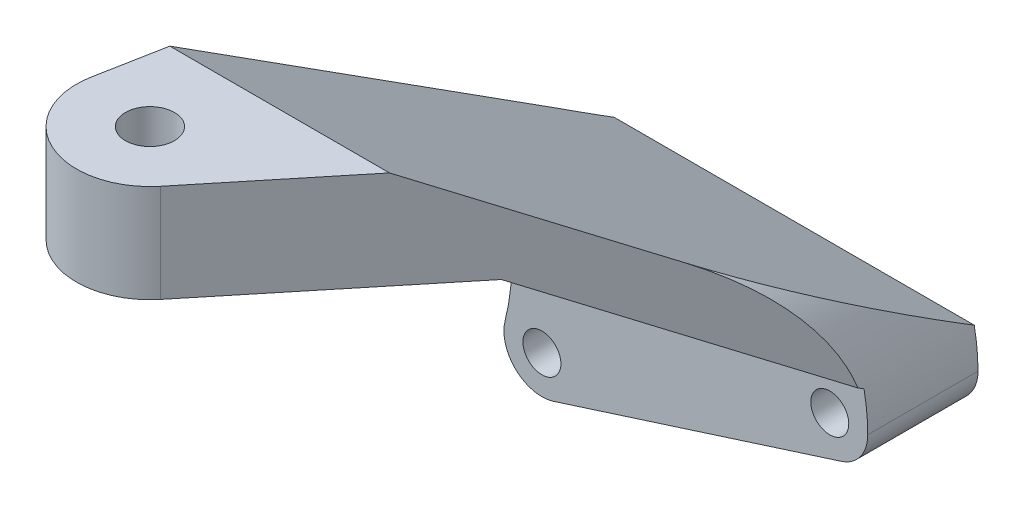
from build123d import *

# Parameters (mm, degrees)
SKETCH1_R            = 1.55
BOSS_EXTRUDE1_DEPTH  = 9
BOSS_EXTRUDE12_DEPTH = 17.39274351
SKETCH7_3_OUTSIDE_W  = 51.494
SKETCH7_3_OUTSIDE_H  = 57.894
SKETCH7_3_OUTSIDE_R  = 2
CUT_EXTRUDE3_DEPTH   = 17.39274351
CUT_EXTRUDE2_DEPTH   = 50
CUT_EXTRUDE5_DEPTH   = 58.797577804
CUT_EXTRUDE7_DEPTH   = 58.797577804
SKETCH15_W           = 41.045636652
SKETCH15_H           = 32.401588668
CUT_EXTRUDE8_DEPTH   = 58.797577804


with BuildPart() as part:
    # Sketch1 → Boss-Extrude1 (new body)
    with BuildSketch(Plane.XY):
        with BuildLine():
            Line((26.6, 7.50725649), (26.6, 10.60725649))
            Line((26.6, 10.60725649), (-3.1, 10.60725649))
            Line((-3.1, 10.60725649), (-3.1, 0))
            ThreePointArc((-3.1, 0), (-1.828333755, -2.503436774), (0.943352052, -2.952979327))
            Line((0.943352052, -2.952979327), (24.443352052, 4.554277162))
            ThreePointArc((24.443352052, 4.554277162), (26.003436774, 5.678922735), (26.6, 7.50725649))
        make_face()
        Circle(SKETCH1_R, mode=Mode.SUBTRACT)
        with Locations((23.5, 7.50725649)):
            Circle(SKETCH1_R, mode=Mode.SUBTRACT)
    extrude(amount=-BOSS_EXTRUDE1_DEPTH)

    # Sketch7 → Boss-Extrude12 (add)
    with BuildSketch(Plane(origin=(0, 28, 0), x_dir=(1, 0, 0), z_dir=(0, 1, 0))):
        with BuildLine():
            Line((-3.1, 0), (-9.895228332, 35.883629581))
            ThreePointArc((-9.895228332, 35.883629581), (-6.533149103, 42.439039954), (0.648143683, 40.794042739))
            Line((0.648143683, 40.794042739), (26.6, 9))
            Line((26.6, 9), (26.6, 0))
            Line((26.6, 0), (-3.1, 0))
        make_face()
    extrude(amount=-BOSS_EXTRUDE12_DEPTH)

    # Sketch7<3> outside → Cut-Extrude3 (cut)
    # profile 1 of 2: a face of its own
    with BuildSketch(Plane(origin=(0, 28, 0), x_dir=(1, 0, 0), z_dir=(0, 1, 0))):
        with Locations((8.3, 21.5)):
            Rectangle(SKETCH7_3_OUTSIDE_W, SKETCH7_3_OUTSIDE_H)
        with BuildLine():
            Line((-3.1, 0), (-9.895228332, 35.883629581))
            ThreePointArc((-9.895228332, 35.883629581), (-6.533149103, 42.439039954), (0.648143683, 40.794042739))
            Line((0.648143683, 40.794042739), (26.6, 9))
            Line((26.6, 9), (26.6, 0))
            Line((26.6, 0), (-3.1, 0))
        make_face(mode=Mode.SUBTRACT)
    # profile 2 of 2: a face of its own
    with BuildSketch(Plane(origin=(0, 28, 0), x_dir=(1, 0, 0), z_dir=(0, 1, 0))):
        with Locations(Location((-4, 37, 0), (0, 0, 270))):
            Circle(SKETCH7_3_OUTSIDE_R)
    extrude(amount=-CUT_EXTRUDE3_DEPTH, mode=Mode.SUBTRACT)

    # Sketch8 → Cut-Extrude2 (cut, symmetric)
    with BuildSketch(Plane(origin=(0, 0, 0), x_dir=(0, 0, -1), z_dir=(1, 0, 0))):
        Polygon((0, 10.60725649), (30.5, 28), (0, 28), align=None)
        Polygon((43, 20), (25.471160912, 20), (9, 10.60725649), (43, 10.60725649), align=None)
    extrude(amount=CUT_EXTRUDE2_DEPTH, both=True, mode=Mode.SUBTRACT)

    # Sketch12 → Cut-Extrude5 (cut, through all)
    with BuildSketch(Plane.XY):
        with BuildLine():
            Line((-3.1, 0), (-7.493582912, 18.705566962))
            ThreePointArc((-7.493582912, 18.705566962), (-3.016370904, 10.284014045), (-3.008825552, 0.746303421))
            ThreePointArc((-3.008825552, 0.746303421), (-3.077121968, 0.375926049), (-3.1, 0))
        make_face()
    extrude(amount=-CUT_EXTRUDE5_DEPTH, mode=Mode.SUBTRACT)

    # Sketch14 → Cut-Extrude7 (cut, through all)
    with BuildSketch(Plane.XY):
        with BuildLine():
            Line((19.851500316, 20.45422786), (26.6, 15.73954146))
            Line((26.6, 15.73954146), (26.6, 7.50725649))
            ThreePointArc((26.6, 7.50725649), (24.811622249, 14.807364633), (19.851500316, 20.45422786))
        make_face()
    extrude(amount=-CUT_EXTRUDE7_DEPTH, mode=Mode.SUBTRACT)

    # Mirror9: part across plane


with BuildPart() as part_1:
    add(part.part)
    add(part.part.mirror(Plane.XY))

    # Sketch15 → Cut-Extrude8 (cut, through all)
    with BuildSketch(Plane.XY):
        with Locations((9.251388929, 12.77619049)):
            Rectangle(SKETCH15_W, SKETCH15_H)
    extrude(amount=-CUT_EXTRUDE8_DEPTH, mode=Mode.SUBTRACT)


solid = part_1.part
